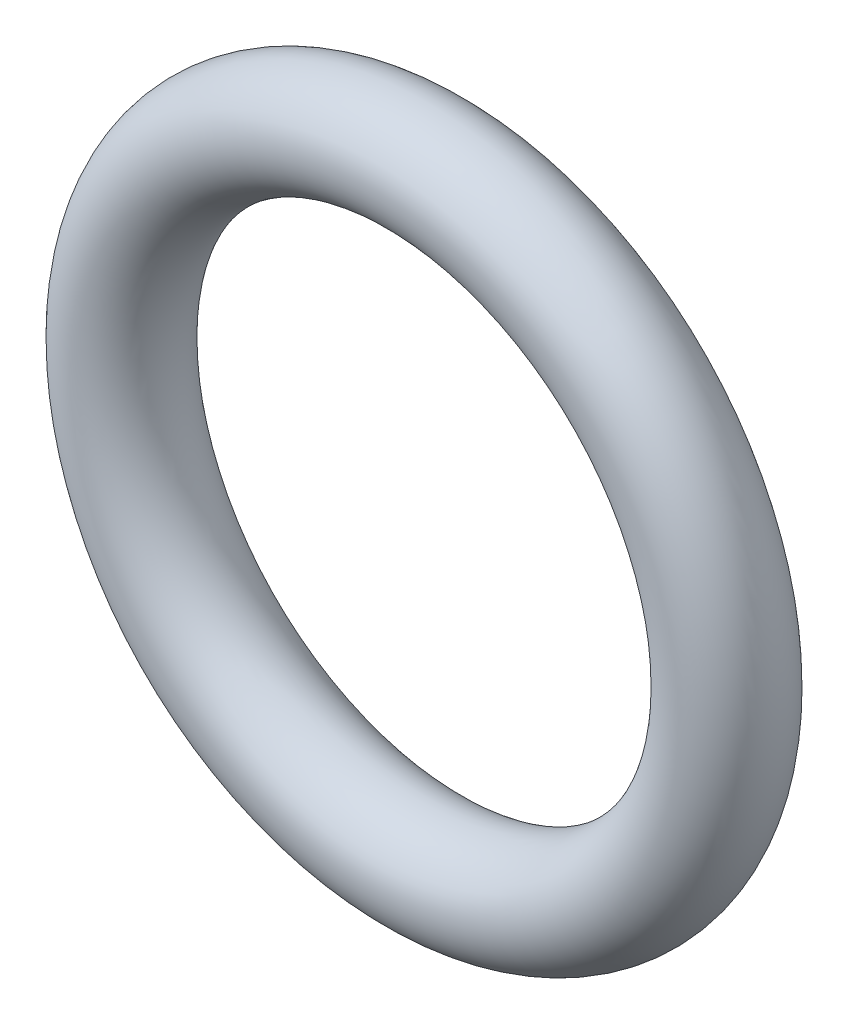
from build123d import *

# Parameters (mm, degrees)
SKETCH1_R = 0.75


with BuildPart() as part:
    # Sketch1 → Revolve1 (revolve)
    with BuildSketch(Plane(origin=(0, 0, 0), x_dir=(1, 0, 0), z_dir=(0, 1, 0))):
        with Locations((4.25, 0)):
            Circle(SKETCH1_R)
    revolve(axis=Axis((0, 0, 0), (0, 0, -1)))


solid = part.part
